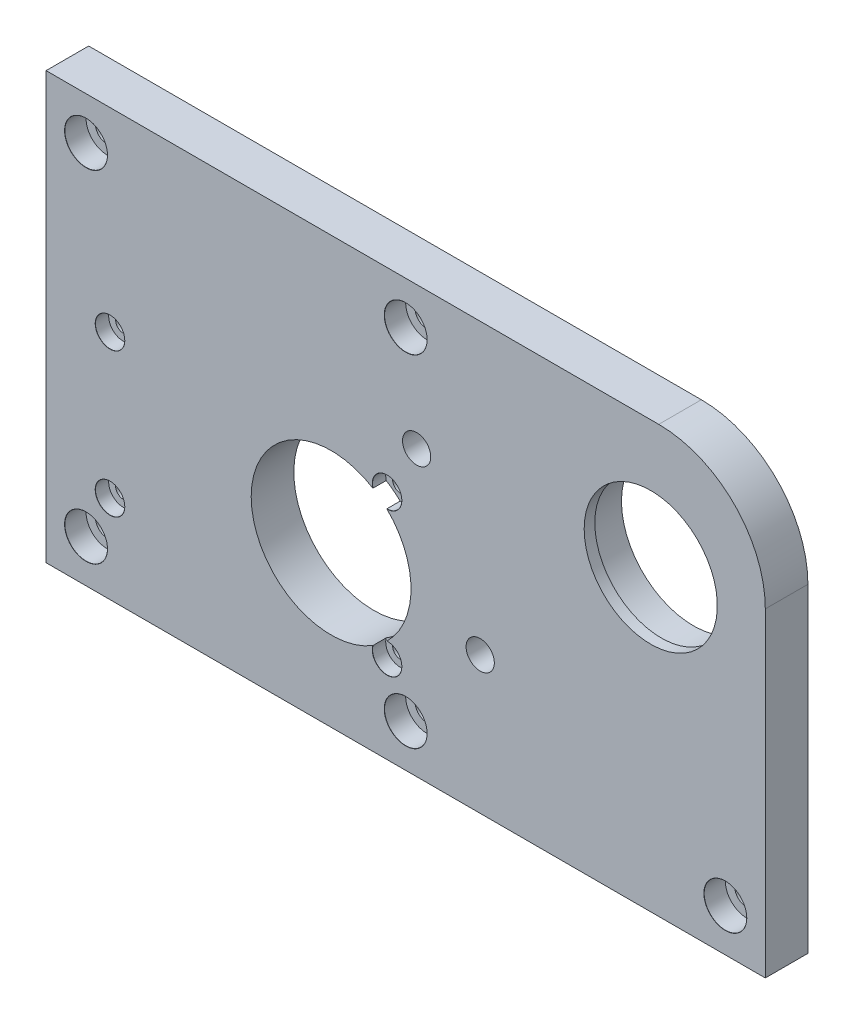
from build123d import *

# Parameters (mm, degrees)
SKETCH1_W                       = 135
SKETCH1_H                       = 80
SKETCH1_R                       = 15
BOSS_EXTRUDE1_DEPTH             = 8
CBORE_FOR_M2_5_SHCS1_AT_2_COUNT = 2
CBORE_FOR_M2_5_SHCS1_AT_2_PITCH = 52
CBORE_FOR_M2_5_SHCS1_AT_3_COUNT = 2
CBORE_FOR_M2_5_SHCS1_AT_3_PITCH = 58.591808301
CBORE_FOR_M2_5_SHCS1_AT_4_COUNT = 2
CBORE_FOR_M2_5_SHCS1_AT_4_PITCH = 27
M5_CLEARANCE_HOLE1_D            = 5.3
M5_CLEARANCE_HOLE1_CSINK_D      = 5.35
M5_CLEARANCE_HOLE1_CSINK_ANGLE  = 90
CBORE_FOR_M4_SHCS1_AT_2_COUNT   = 2
CBORE_FOR_M4_SHCS1_AT_2_PITCH   = 60
CBORE_FOR_M4_SHCS1_AT_3_COUNT   = 2
CBORE_FOR_M4_SHCS1_AT_3_PITCH   = 120
CBORE_FOR_M4_SHCS1_AT_4_COUNT   = 2
CBORE_FOR_M4_SHCS1_AT_4_PITCH   = 64
CBORE_FOR_M4_SHCS1_AT_5_COUNT   = 2
CBORE_FOR_M4_SHCS1_AT_5_PITCH   = 87.726848798
FILLET1_R                       = 20


with BuildPart() as part:
    # Sketch1 → Boss-Extrude1 (new body)
    with BuildSketch(Plane.XY):
        with Locations((14, 10)):
            Rectangle(SKETCH1_W, SKETCH1_H)
        Circle(SKETCH1_R, mode=Mode.SUBTRACT)
    extrude(amount=BOSS_EXTRUDE1_DEPTH)

    # Sketch3 → CBORE for M2.5 SHCS1 (revolve, cut)
    with BuildSketch(Plane(origin=(10.5, 13.5, 8), x_dir=(0, -1, 0), z_dir=(1, 0, 0))):
        Polygon((0, 0), (0, 8), (1.45, 8), (1.45, 2.5), (2.75, 2.5), (2.75, 0.025), (2.775, 0), align=None)
    cbore_for_m2_5_shcs1 = revolve(axis=Axis((10.5, 13.5, 14.35), (0, 0, -1)), mode=Mode.SUBTRACT)

    # CBORE for M2.5 SHCS1 at 2: CBORE for M2.5 SHCS1 ×2
    with Locations(*[(-i * CBORE_FOR_M2_5_SHCS1_AT_2_PITCH, 0, 0) for i in range(1, CBORE_FOR_M2_5_SHCS1_AT_2_COUNT)]):
        add(cbore_for_m2_5_shcs1, mode=Mode.SUBTRACT)

    # CBORE for M2.5 SHCS1 at 3: CBORE for M2.5 SHCS1 ×2
    with Locations(*[Vector(-0.8874960768017396, -0.4608152706470573, 0) * (i * CBORE_FOR_M2_5_SHCS1_AT_3_PITCH) for i in range(1, CBORE_FOR_M2_5_SHCS1_AT_3_COUNT)]):
        add(cbore_for_m2_5_shcs1, mode=Mode.SUBTRACT)

    # CBORE for M2.5 SHCS1 at 4: CBORE for M2.5 SHCS1 ×2
    with Locations(*[(0, -i * CBORE_FOR_M2_5_SHCS1_AT_4_PITCH, 0) for i in range(1, CBORE_FOR_M2_5_SHCS1_AT_4_COUNT)]):
        add(cbore_for_m2_5_shcs1, mode=Mode.SUBTRACT)

    # Sketch4 → Cut-Revolve1 (revolve, cut)
    with BuildSketch(Plane(origin=(60, 0, 0), x_dir=(0, 0, -1), z_dir=(1, 0, 0))):
        Polygon((-8, 26), (0, 26), (0, 39.5), (-6, 39.5), (-6, 38.5), (-8, 38.5), align=None)
    revolve(axis=Axis((60, 26, 0), (0, 0, 1)), mode=Mode.SUBTRACT)

    # M5 Clearance Hole1 (through all)
    with Locations(Plane(origin=(0, 0, 0), x_dir=(-1, 0, 0), z_dir=(0, 0, -1))):
        with Locations((-16.057223443, 23.305912883), (-27.985446572, -4.220755876)):
            CounterSinkHole(M5_CLEARANCE_HOLE1_D / 2, M5_CLEARANCE_HOLE1_CSINK_D / 2, counter_sink_angle=M5_CLEARANCE_HOLE1_CSINK_ANGLE)

    # Sketch13 → CBORE for M4 SHCS1 (revolve, cut)
    with BuildSketch(Plane(origin=(-46, -22, 8), x_dir=(0, -1, 0), z_dir=(1, 0, 0))):
        Polygon((0, 0), (0, 8), (2.25, 8), (2.25, 4), (4, 4), (4, 0.025), (4.025, 0), align=None)
    cbore_for_m4_shcs1 = revolve(axis=Axis((-46, -22, 14.35), (0, 0, -1)), mode=Mode.SUBTRACT)

    # CBORE for M4 SHCS1 at 2: CBORE for M4 SHCS1 ×2
    with Locations(*[(i * CBORE_FOR_M4_SHCS1_AT_2_PITCH, 0, 0) for i in range(1, CBORE_FOR_M4_SHCS1_AT_2_COUNT)]):
        add(cbore_for_m4_shcs1, mode=Mode.SUBTRACT)

    # CBORE for M4 SHCS1 at 3: CBORE for M4 SHCS1 ×2
    with Locations(*[(i * CBORE_FOR_M4_SHCS1_AT_3_PITCH, 0, 0) for i in range(1, CBORE_FOR_M4_SHCS1_AT_3_COUNT)]):
        add(cbore_for_m4_shcs1, mode=Mode.SUBTRACT)

    # CBORE for M4 SHCS1 at 4: CBORE for M4 SHCS1 ×2
    with Locations(*[(0, i * CBORE_FOR_M4_SHCS1_AT_4_PITCH, 0) for i in range(1, CBORE_FOR_M4_SHCS1_AT_4_COUNT)]):
        add(cbore_for_m4_shcs1, mode=Mode.SUBTRACT)

    # CBORE for M4 SHCS1 at 5: CBORE for M4 SHCS1 ×2
    with Locations(*[Vector(0.6839411288813297, 0.7295372041400852, 0) * (i * CBORE_FOR_M4_SHCS1_AT_5_PITCH) for i in range(1, CBORE_FOR_M4_SHCS1_AT_5_COUNT)]):
        add(cbore_for_m4_shcs1, mode=Mode.SUBTRACT)

    # Fillet1
    fillet1_edges = [part.edges().sort_by_distance(p)[0] for p in [
        (81.5, 50, 4),
    ]]
    fillet(fillet1_edges, radius=FILLET1_R)


solid = part.part
